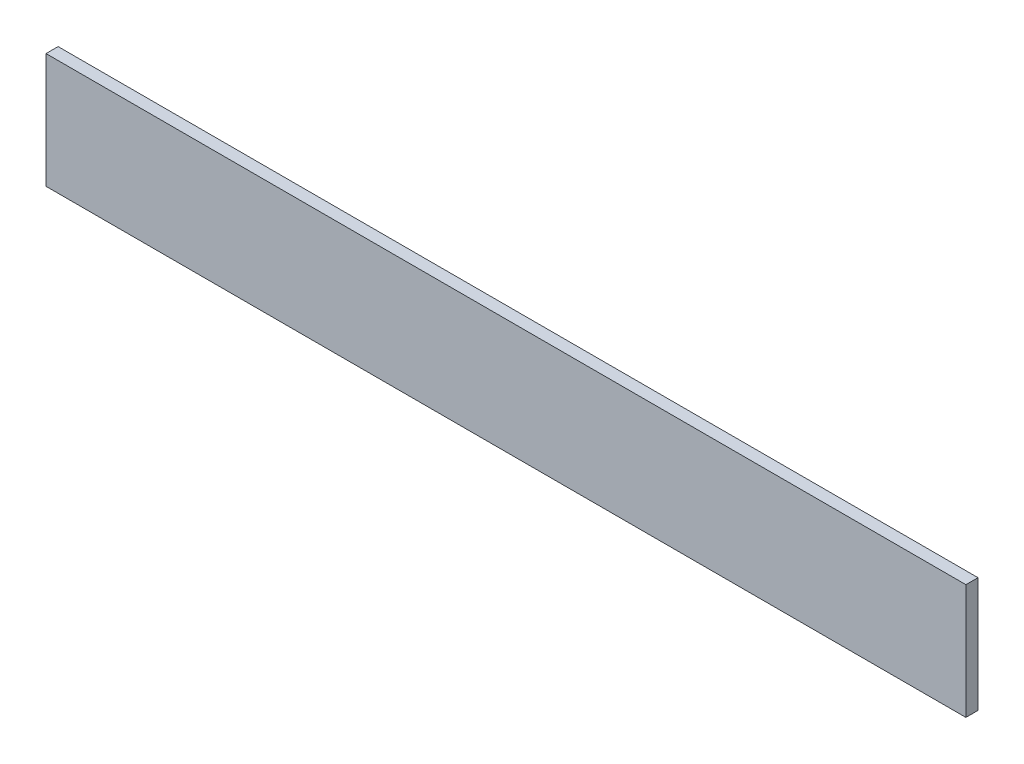
from build123d import *

# Parameters (mm, degrees)
ESQUISSE1_W        = 380
ESQUISSE1_H        = 47.5
BOSS_EXTRU_1_DEPTH = 5


with BuildPart() as part:
    # Esquisse1 → Boss.-Extru.1 (new body)
    with BuildSketch(Plane.XY):
        with Locations((47.333177467, 46.803691275)):
            Rectangle(ESQUISSE1_W, ESQUISSE1_H)
    extrude(amount=BOSS_EXTRU_1_DEPTH)


solid = part.part
